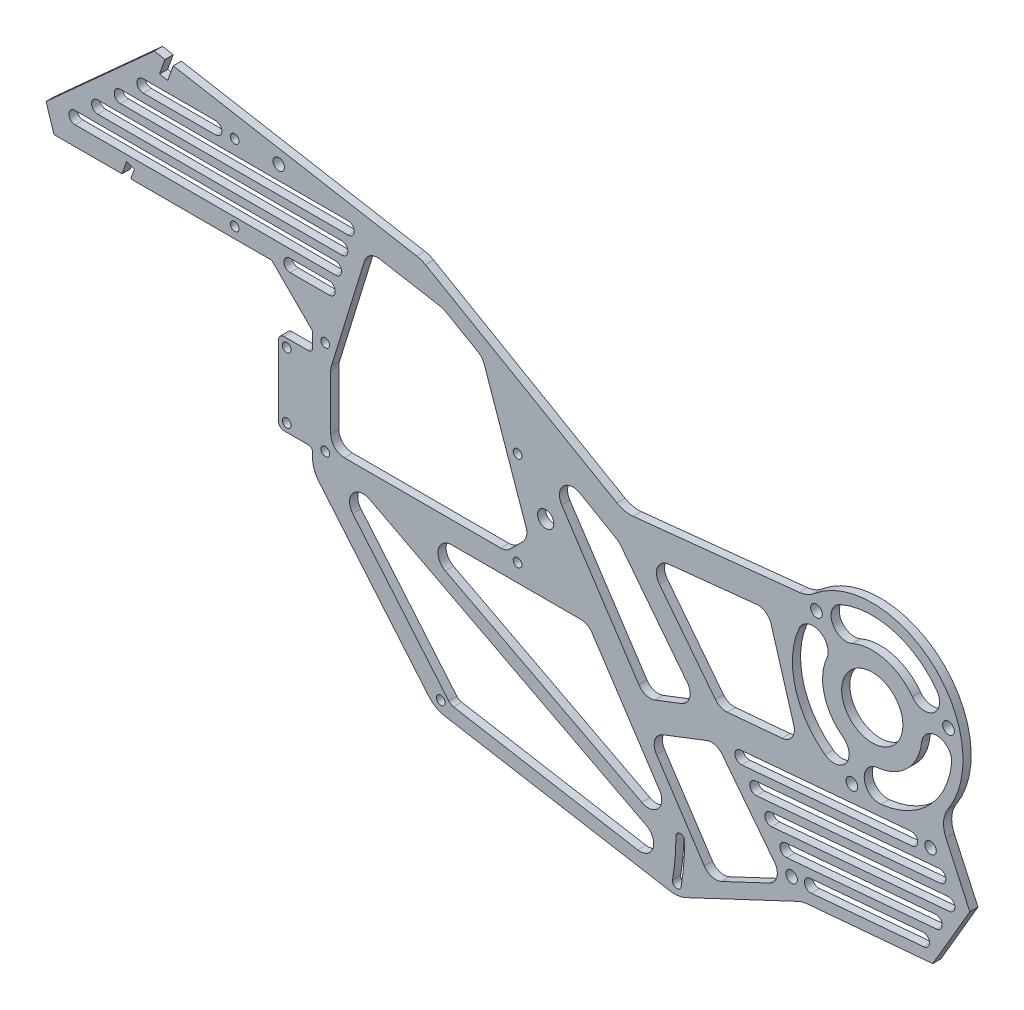
from build123d import *

# Parameters (mm, degrees)
SKETCH2_R           = 1.6
SKETCH2_R_2         = 3
SKETCH2_R_3         = 2.15
SKETCH2_R_4         = 11.25
BOSS_EXTRUDE1_DEPTH = 3
SKETCH3_R           = 2.1
CUT_EXTRUDE1_DEPTH  = 3
CHAMFER1_SIZE       = 15
SKETCH4_R           = 2.1
SKETCH4_R_2         = 1.6
CUT_EXTRUDE2_DEPTH  = 3
FILLET1_R           = 10


with BuildPart() as part:
    # Sketch2 → Boss-Extrude1 (new body)
    with BuildSketch(Plane.XY):
        with BuildLine():
            Line((53.072748858, 40.6), (-21.579444652, 83.700464019))
            Line((-21.579444652, 83.700464019), (-119.68998855, 101))
            Line((-119.68998855, 101), (-159.487793795, 65.062774312))
            Line((-159.487793795, 65.062774312), (-156.543119919, 56))
            Line((-156.543119919, 56), (-61.543119919, 56))
            Line((-61.543119919, 56), (-61.543119919, 35.5))
            ThreePointArc((-61.543119919, 35.5), (-61.982459747, 34.439339828), (-63.043119919, 34))
            Line((-63.043119919, 34), (-72.043119919, 34))
            ThreePointArc((-72.043119919, 34), (-73.457333481, 33.414213562), (-74.043119919, 32))
            Line((-74.043119919, 32), (-74.043119919, 6))
            ThreePointArc((-74.043119919, 6), (-73.457333481, 4.585786438), (-72.043119919, 4))
            Line((-72.043119919, 4), (-63.043119919, 4))
            ThreePointArc((-63.043119919, 4), (-61.982459747, 3.560660172), (-61.543119919, 2.5))
            Line((-61.543119919, 2.5), (-61.543119919, -3))
            Line((-61.543119919, -3), (-16.547987241, -56.623111018))
            Line((-16.547987241, -56.623111018), (72.859854899, -72.031477158))
            Line((72.859854899, -72.031477158), (118.416064539, -50.57316535))
            Line((118.416064539, -50.57316535), (166.335206283, -46.380783682))
            Line((166.335206283, -46.380783682), (179.967845208, -23.075180151))
            Line((179.967845208, -23.075180151), (168.696372884, 1.459568914))
            ThreePointArc((168.696372884, 1.459568914), (167.192682283, 48.077579877), (120.552871509, 47.6))
            Line((120.552871509, 47.6), (53.072748858, 40.6))
        make_face()
        with Locations((-56.873138671, 39.6)):
            Circle(SKETCH2_R, mode=Mode.SUBTRACT)
        with Locations((13.786898833, 39.6)):
            Circle(SKETCH2_R, mode=Mode.SUBTRACT)
        with Locations((13.786898833, 5)):
            Circle(SKETCH2_R, mode=Mode.SUBTRACT)
        with Locations((-56.873138671, 5)):
            Circle(SKETCH2_R, mode=Mode.SUBTRACT)
        with Locations((24.116880081, 24)):
            Circle(SKETCH2_R_2, mode=Mode.SUBTRACT)
        with Locations((123.610783427, 44.506096654)):
            Circle(SKETCH2_R_3, mode=Mode.SUBTRACT)
        with Locations((172.128729044, 31.505752308)):
            Circle(SKETCH2_R_3, mode=Mode.SUBTRACT)
        with Locations((136.611127773, -4.011848962)):
            Circle(SKETCH2_R_3, mode=Mode.SUBTRACT)
        with Locations((144.116880081, 24)):
            Circle(SKETCH2_R_4, mode=Mode.SUBTRACT)
        with Locations((-14.425271898, -52.929969347)):
            Circle(SKETCH2_R, mode=Mode.SUBTRACT)
        with Locations((-71.043119919, 31)):
            Circle(SKETCH2_R, mode=Mode.SUBTRACT)
        with Locations((-71.043119919, 7)):
            Circle(SKETCH2_R, mode=Mode.SUBTRACT)
        with BuildLine():
            Line((-42.743119919, 62.05), (-42.743119919, 39.5))
            Line((-42.743119919, 39.5), (-51.373138671, 39.5))
            ThreePointArc((-51.373138671, 39.5), (-52.433798843, 39.060660172), (-52.873138671, 38))
            Line((-52.873138671, 38), (-52.873138671, 10))
            ThreePointArc((-52.873138671, 10), (-52.433798843, 8.939339828), (-51.373138671, 8.5))
            Line((-51.373138671, 8.5), (8.286898833, 8.5))
            ThreePointArc((8.286898833, 8.5), (9.347559005, 8.939339828), (9.786898833, 10))
            Line((9.786898833, 10), (9.786898833, 38))
            ThreePointArc((9.786898833, 38), (9.347559005, 39.060660172), (8.286898833, 39.5))
            Line((8.286898833, 39.5), (-0.343119919, 39.5))
            Line((-0.343119919, 39.5), (-0.343119919, 62.05))
            ThreePointArc((-0.343119919, 62.05), (0.187210167, 63.330330086), (-1.093119919, 62.8))
            Line((-1.093119919, 62.8), (-41.993119919, 62.8))
            ThreePointArc((-41.993119919, 62.8), (-43.273450005, 63.330330086), (-42.743119919, 62.05))
        make_face(mode=Mode.SUBTRACT)
        with BuildLine():
            ThreePointArc((126.757039397, 0.334446311), (134.51482266, 1.526838378), (133.322430592, 9.284621641))
            ThreePointArc((133.322430592, 9.284621641), (126.488733751, 19.276552427), (127.410923425, 31.346666741))
            ThreePointArc((127.410923425, 31.346666741), (124.564673615, 38.661300157), (117.250040198, 35.815050347))
            ThreePointArc((117.250040198, 35.815050347), (115.76695708, 16.403661026), (126.757039397, 0.334446311))
        make_face(mode=Mode.SUBTRACT)
        with BuildLine():
            ThreePointArc((132.301829734, 50.866839883), (129.455579924, 43.552206466), (136.770213341, 40.705956656))
            ThreePointArc((136.770213341, 40.705956656), (148.840327654, 41.62814633), (158.83225844, 34.794449489))
            ThreePointArc((158.83225844, 34.794449489), (166.590041703, 33.602057421), (167.78243377, 41.359840685))
            ThreePointArc((167.78243377, 41.359840685), (151.713219055, 52.349923002), (132.301829734, 50.866839883))
        make_face(mode=Mode.SUBTRACT)
        with BuildLine():
            ThreePointArc((173.291771113, 20.798713806), (168.38023766, 26.920955155), (162.25799631, 22.009421702))
            ThreePointArc((162.25799631, 22.009421702), (157.021578838, 11.095301243), (146.107458379, 5.858883771))
            ThreePointArc((146.107458379, 5.858883771), (141.195924926, -0.263357578), (147.318166275, -5.174891032))
            ThreePointArc((147.318166275, -5.174891032), (164.870464109, 3.246415972), (173.291771113, 20.798713806))
        make_face(mode=Mode.SUBTRACT)
        with BuildLine():
            ThreePointArc((70.719562813, -67.603657434), (71.660364881, -60.293605711), (71.974728102, -52.929969347))
            ThreePointArc((71.974728102, -52.929969347), (73.574728102, -51.329969347), (75.174728102, -52.929969347))
            ThreePointArc((75.174728102, -52.929969347), (74.848721798, -60.566332984), (73.87307521, -68.147127363))
            ThreePointArc((73.87307521, -68.147127363), (72.024584047, -69.452148597), (70.719562813, -67.603657434))
        make_face(mode=Mode.SUBTRACT)
    extrude(amount=-BOSS_EXTRUDE1_DEPTH)

    # Sketch3 → Cut-Extrude1 (cut)
    with BuildSketch(Plane.XY):
        with Locations((165.536048214, -9.882069825)):
            Circle(SKETCH3_R)
        with Locations((114.491807572, -44.622601361)):
            Circle(SKETCH3_R)
        with BuildLine():
            Line((57.960342729, -64.390017797), (-9.759872076, -52.719253356))
            ThreePointArc((-9.759872076, -52.719253356), (-10.745337183, -52.363810337), (-11.548502347, -51.691198313))
            Line((-11.548502347, -51.691198313), (-46.771605953, -9.713938048))
            ThreePointArc((-46.771605953, -9.713938048), (-46.840872828, -3.370465716), (-40.632829648, -2.064847464))
            Line((-40.632829648, -2.064847464), (61.118068582, -55.027502141))
            ThreePointArc((61.118068582, -55.027502141), (63.547301323, -61.060583323), (57.960342729, -64.390017797))
        make_face()
        with BuildLine():
            Line((65.945318974, -41.343190105), (41.19195838, -3.750275648))
            ThreePointArc((41.19195838, -3.750275648), (39.387807113, -2.098374064), (37.015953593, -1.5))
            Line((37.015953593, -1.5), (-10.453515965, -1.5))
            ThreePointArc((-10.453515965, -1.5), (-15.310251632, -5.311674009), (-12.762070054, -10.935152536))
            Line((-12.762070054, -10.935152536), (59.460760097, -48.528066993))
            ThreePointArc((59.460760097, -48.528066993), (65.481113885, -47.442920874), (65.945318974, -41.343190105))
        make_face()
        with BuildLine():
            Line((11.094510678, 7.964466094), (15.726355347, 12.596310763))
            ThreePointArc((15.726355347, 12.596310763), (17.064501827, 15.015045899), (16.913073076, 17.775115643))
            Line((16.913073076, 17.775115643), (1.510457246, 62.037461247))
            ThreePointArc((1.510457246, 62.037461247), (0.641130282, 63.580876871), (-0.711794389, 64.724317292))
            Line((-0.711794389, 64.724317292), (-12.771349016, 71.686904402))
            ThreePointArc((-12.771349016, 71.686904402), (-13.561248299, 72.055240487), (-14.403108128, 72.280816148))
            Line((-14.403108128, 72.280816148), (-36.828638856, 76.235042272))
            ThreePointArc((-36.828638856, 76.235042272), (-40.305400828, 75.576635671), (-42.475672175, 72.781766203))
            Line((-42.475672175, 72.781766203), (-54.651931101, 33.218746173))
            ThreePointArc((-54.651931101, 33.218746173), (-54.817527519, 32.491635899), (-54.873138671, 31.747983477))
            Line((-54.873138671, 31.747983477), (-54.873138671, 11.5))
            ThreePointArc((-54.873138671, 11.5), (-53.408672577, 7.964466094), (-49.873138671, 6.5))
            Line((-49.873138671, 6.5), (7.558976772, 6.5))
            ThreePointArc((7.558976772, 6.5), (9.472393934, 6.880602337), (11.094510678, 7.964466094))
        make_face()
        with BuildLine():
            Line((88.719485092, -59.034217482), (106.362949054, -50.723628123))
            ThreePointArc((106.362949054, -50.723628123), (109.095703292, -47.361167418), (108.176242004, -43.126940374))
            Line((108.176242004, -43.126940374), (88.998218256, -18.516628232))
            ThreePointArc((88.998218256, -18.516628232), (86.389642135, -16.771601793), (83.254955254, -16.924979777))
            Line((83.254955254, -16.924979777), (67.192058087, -23.120633555))
            ThreePointArc((67.192058087, -23.120633555), (64.230023371, -26.25947304), (64.81540476, -30.535369624))
            Line((64.81540476, -30.535369624), (82.412861712, -57.260617348))
            ThreePointArc((82.412861712, -57.260617348), (85.235235999, -59.324175084), (88.719485092, -59.034217482))
        make_face()
        with BuildLine():
            Line((64.308783334, -13.51466082), (74.009689094, -9.7729041))
            ThreePointArc((74.009689094, -9.7729041), (77.028727335, -6.443227804), (76.154249177, -2.03452912))
            Line((76.154249177, -2.03452912), (51.592478456, 29.484508093))
            ThreePointArc((51.592478456, 29.484508093), (50.931227843, 30.182634884), (50.148566914, 30.741271849))
            Line((50.148566914, 30.741271849), (36.666208285, 38.525315232))
            ThreePointArc((36.666208285, 38.525315232), (30.528444979, 37.625447406), (29.990203498, 31.445463861))
            Line((29.990203498, 31.445463861), (58.333427086, -11.599373455))
            ThreePointArc((58.333427086, -11.599373455), (60.983259641, -13.611035279), (64.308783334, -13.51466082))
        make_face()
        with BuildLine():
            Line((110.931453753, -2.342541805), (90.802007139, -4.103640186))
            ThreePointArc((90.802007139, -4.103640186), (88.369607985, -3.706715869), (86.422316883, -2.196029959))
            Line((86.422316883, -2.196029959), (65.866447884, 24.182410231))
            ThreePointArc((65.866447884, 24.182410231), (65.210388037, 29.215432448), (69.294456506, 32.229086693))
            Line((69.294456506, 32.229086693), (101.631570395, 35.583552991))
            ThreePointArc((101.631570395, 35.583552991), (104.926584468, 34.766745681), (106.940507013, 32.033906882))
            Line((106.940507013, 32.033906882), (115.427648188, 3.460405449))
            ThreePointArc((115.427648188, 3.460405449), (114.448109634, -0.42396293), (110.931453753, -2.342541805))
        make_face()
        with BuildLine():
            Line((163.087199309, -42.649668121), (121.663008925, -46.273815175))
            ThreePointArc((121.663008925, -46.273815175), (119.203866445, -44.210349628), (121.267331993, -41.751207148))
            Line((121.267331993, -41.751207148), (162.691522377, -38.127060094))
            ThreePointArc((162.691522377, -38.127060094), (165.150664856, -40.190525641), (163.087199309, -42.649668121))
        make_face()
        with BuildLine():
            Line((167.753305368, -34.672751952), (112.654740906, -39.493251719))
            ThreePointArc((112.654740906, -39.493251719), (110.195598426, -37.429786172), (112.259063974, -34.970643692))
            Line((112.259063974, -34.970643692), (167.357628436, -30.150143925))
            ThreePointArc((167.357628436, -30.150143925), (169.816770916, -32.213609473), (167.753305368, -34.672751952))
        make_face()
        with BuildLine():
            Line((172.419411428, -26.695835784), (107.13315433, -32.407643164))
            ThreePointArc((107.13315433, -32.407643164), (104.674011851, -30.344177616), (106.737477398, -27.885035137))
            Line((106.737477398, -27.885035137), (172.023734496, -22.173227757))
            ThreePointArc((172.023734496, -22.173227757), (174.482876975, -24.236693304), (172.419411428, -26.695835784))
        make_face()
        with BuildLine():
            Line((169.076649054, -19.419604811), (101.611567754, -25.322034609))
            ThreePointArc((101.611567754, -25.322034609), (99.152425275, -23.258569061), (101.215890822, -20.799426582))
            Line((101.215890822, -20.799426582), (168.680972122, -14.896996784))
            ThreePointArc((168.680972122, -14.896996784), (171.140114601, -16.960462332), (169.076649054, -19.419604811))
        make_face()
        with BuildLine():
            Line((158.760523793, -12.753464037), (96.089981179, -18.236426053))
            ThreePointArc((96.089981179, -18.236426053), (93.630838699, -16.172960506), (95.694304247, -13.713818026))
            Line((95.694304247, -13.713818026), (158.364846861, -8.230856011))
            ThreePointArc((158.364846861, -8.230856011), (160.823989341, -10.294321558), (158.760523793, -12.753464037))
        make_face()
    extrude(amount=-CUT_EXTRUDE1_DEPTH, mode=Mode.SUBTRACT)

    # Chamfer1
    chamfer1_edges = [part.edges().sort_by_distance(p)[0] for p in [
        (-61.543119919, 56, -1.5),
    ]]
    chamfer(chamfer1_edges, length=CHAMFER1_SIZE)

    # Sketch4 → Cut-Extrude2 (cut)
    with BuildSketch(Plane.XY):
        with Locations((-73.962867942, 87.859941827)):
            Circle(SKETCH4_R)
        with Locations((-90.149553201, 87.859941827)):
            Circle(SKETCH4_R_2)
        with Locations((-90.149553201, 60)):
            Circle(SKETCH4_R_2)
        with BuildLine():
            Line((-53.157891964, 63), (-148.813602815, 63))
            ThreePointArc((-148.813602815, 63), (-151.083544642, 65.269941827), (-148.813602815, 67.539883655))
            Line((-148.813602815, 67.539883655), (-53.157891964, 67.539883655))
            ThreePointArc((-53.157891964, 67.539883655), (-50.887950137, 65.269941827), (-53.157891964, 63))
        make_face()
        with BuildLine():
            Line((-50.840393713, 70.53), (-140.474687727, 70.53))
            ThreePointArc((-140.474687727, 70.53), (-142.744629554, 72.799941827), (-140.474687727, 75.069883655))
            Line((-140.474687727, 75.069883655), (-50.840393713, 75.069883655))
            ThreePointArc((-50.840393713, 75.069883655), (-48.570451886, 72.799941827), (-50.840393713, 70.53))
        make_face()
        with BuildLine():
            Line((-48.522895463, 78.06), (-132.135772639, 78.06))
            ThreePointArc((-132.135772639, 78.06), (-134.405714467, 80.329941827), (-132.135772639, 82.599883655))
            Line((-132.135772639, 82.599883655), (-48.522895463, 82.599883655))
            ThreePointArc((-48.522895463, 82.599883655), (-46.252953635, 80.329941827), (-48.522895463, 78.06))
        make_face()
        with BuildLine():
            Line((-97.149553201, 85.59), (-123.796857552, 85.59))
            ThreePointArc((-123.796857552, 85.59), (-126.066799379, 87.859941827), (-123.796857552, 90.129883655))
            Line((-123.796857552, 90.129883655), (-97.149553201, 90.129883655))
            ThreePointArc((-97.149553201, 90.129883655), (-94.879611373, 87.859941827), (-97.149553201, 85.59))
        make_face()
        Polygon((-128.358239078, 56), (-127.015231616, 59.767801874), (-129.841083022, 60.77505747), (-131.543119919, 56), align=None)
        Polygon((-112.7542113, 99.777035339), (-114.768722492, 94.125332528), (-117.76526873, 94.653704479), (-115.750757538, 100.305407289), align=None)
        with BuildLine():
            Line((-55.475390215, 55.47), (-69.797780372, 55.47))
            ThreePointArc((-69.797780372, 55.47), (-72.067722199, 57.739941827), (-69.797780372, 60.009883655))
            Line((-69.797780372, 60.009883655), (-55.475390215, 60.009883655))
            ThreePointArc((-55.475390215, 60.009883655), (-53.205448388, 57.739941827), (-55.475390215, 55.47))
        make_face()
    extrude(amount=-CUT_EXTRUDE2_DEPTH, mode=Mode.SUBTRACT)

    # Fillet1
    fillet1_edges = [part.edges().sort_by_distance(p)[0] for p in [
        (120.552871509, 47.6, -1.5),
        (168.696372884, 1.459568914, -1.5),
        (118.416064539, -50.57316535, -1.5),
        (72.859854899, -72.031477158, -1.5),
        (-16.547987241, -56.623111018, -1.5),
        (-61.543119919, -3, -1.5),
        (-21.579444652, 83.700464019, -1.5),
        (53.072748858, 40.6, -1.5),
    ]]
    fillet(fillet1_edges, radius=FILLET1_R)


solid = part.part
